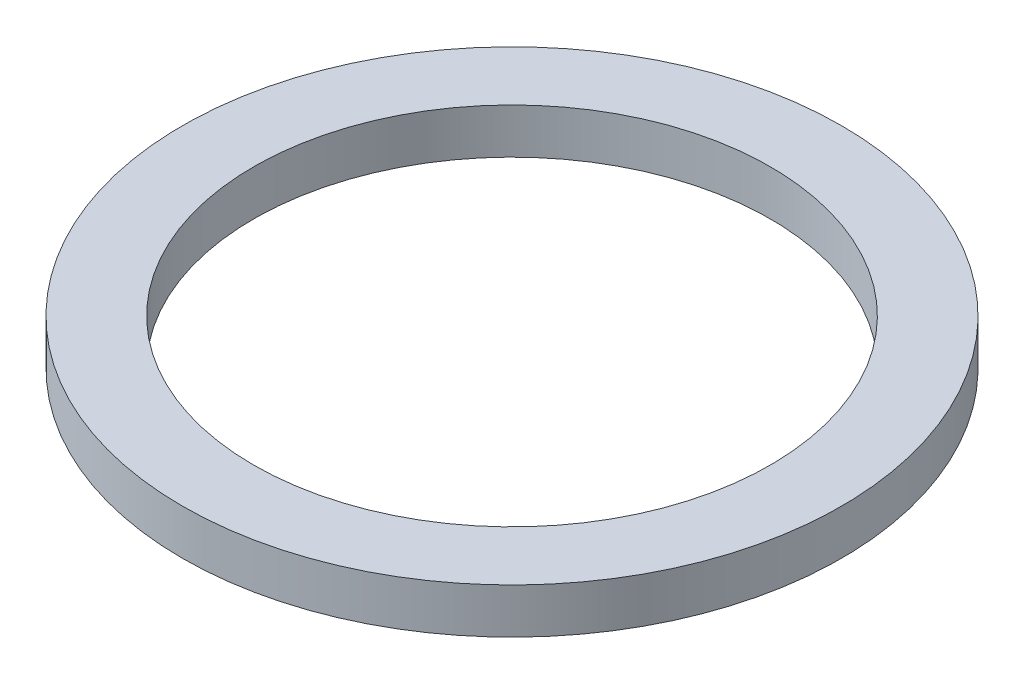
from build123d import *

# Parameters (mm, degrees)
SKETCH1_R           = 21.875
SKETCH1_R_2         = 17.15
BOSS_EXTRUDE1_DEPTH = 3


with BuildPart() as part:
    # Sketch1 → Boss-Extrude1 (new body)
    with BuildSketch(Plane(origin=(0, 0, 0), x_dir=(1, 0, 0), z_dir=(0, 1, 0))):
        with Locations(Location((0, 0, 0), (0, 0, 270))):
            Circle(SKETCH1_R)
        with Locations(Location((0, 0, 0), (0, 0, 270))):
            Circle(SKETCH1_R_2, mode=Mode.SUBTRACT)
    extrude(amount=BOSS_EXTRUDE1_DEPTH)


solid = part.part
